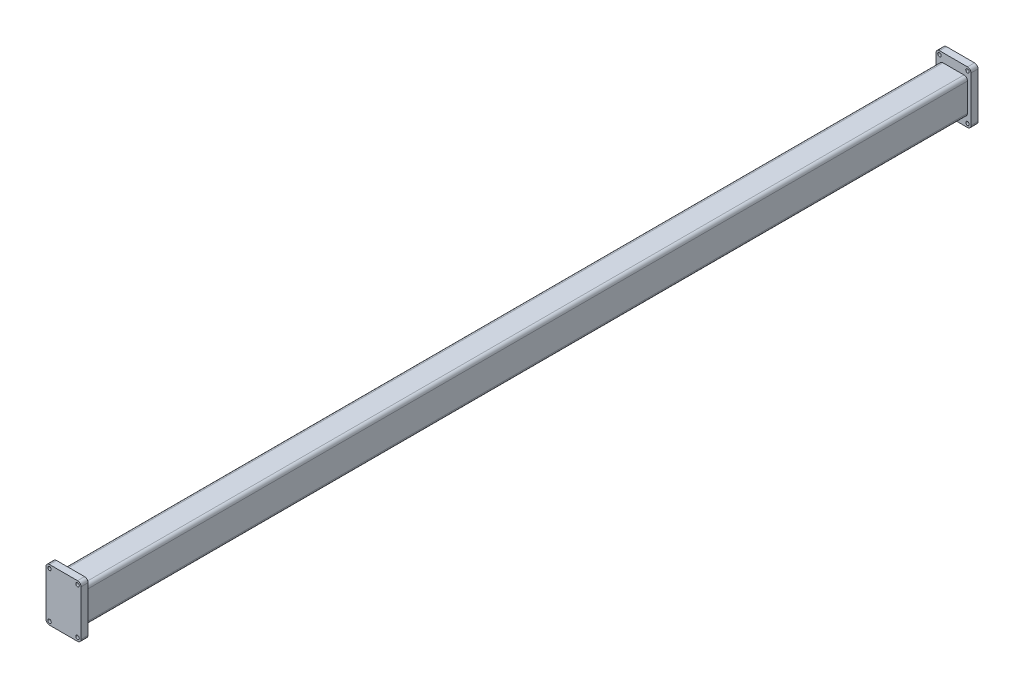
from build123d import *

# Parameters (mm, degrees)
SKETCH_1_R        = 0.5
EXTRUDE_1_DEPTH   = 2
SKETCH_2_W        = 6
SKETCH_2_H        = 8
EXTRUDE_1_2_DEPTH = 126
SCALE_1_SCALE     = 2
SCALE_2_SCALE     = 1.7


with BuildPart() as part:
    # 草图1 → Extrude 1 (new body)
    with BuildSketch(Plane.XY):
        with BuildLine():
            Line((-4, 7.5), (4, 7.5))
            ThreePointArc((4, 7.5), (4.707106781, 7.207106781), (5, 6.5))
            Line((5, 6.5), (5, -6.5))
            ThreePointArc((5, -6.5), (4.707106781, -7.207106781), (4, -7.5))
            Line((4, -7.5), (-4, -7.5))
            ThreePointArc((-4, -7.5), (-4.707106781, -7.207106781), (-5, -6.5))
            Line((-5, -6.5), (-5, 6.5))
            ThreePointArc((-5, 6.5), (-4.707106781, 7.207106781), (-4, 7.5))
        make_face()
        with Locations((4, 6.5)):
            Circle(SKETCH_1_R, mode=Mode.SUBTRACT)
        with Locations((-4, 6.5)):
            Circle(SKETCH_1_R, mode=Mode.SUBTRACT)
        with Locations((4, -6.5)):
            Circle(SKETCH_1_R, mode=Mode.SUBTRACT)
        with Locations((-4, -6.5)):
            Circle(SKETCH_1_R, mode=Mode.SUBTRACT)
    extrude(amount=EXTRUDE_1_DEPTH)

    # 草图2 → Extrude 1 2 (add)
    with BuildSketch(Plane(origin=(0, 0, 0), x_dir=(-1, 0, 0), z_dir=(0, 0, -1))):
        with BuildLine():
            Line((-3, 5), (3, 5))
            ThreePointArc((3, 5), (3.707106781, 4.707106781), (4, 4))
            Line((4, 4), (4, -4))
            ThreePointArc((4, -4), (3.707106781, -4.707106781), (3, -5))
            Line((3, -5), (-3, -5))
            ThreePointArc((-3, -5), (-3.707106781, -4.707106781), (-4, -4))
            Line((-4, -4), (-4, 4))
            ThreePointArc((-4, 4), (-3.707106781, 4.707106781), (-3, 5))
        make_face()
        Rectangle(SKETCH_2_W, SKETCH_2_H, mode=Mode.SUBTRACT)
    extrude(amount=EXTRUDE_1_2_DEPTH)

    # 镜向1: part across plane


with BuildPart() as part_1:
    add(part.part)
    add(part.part.mirror(Plane(origin=(3, -4, -126), x_dir=(1, 0, 0), z_dir=(0, 0, -1))))


with BuildPart() as part_2:
    # 缩放比例1: scaled about (0, 0, 0)
    add(part_1.part.scale(SCALE_1_SCALE))


with BuildPart() as part_3:
    # 缩放比例2: scaled about (0, 0, 0)
    add(part_2.part.scale(SCALE_2_SCALE))


solid = part_3.part
